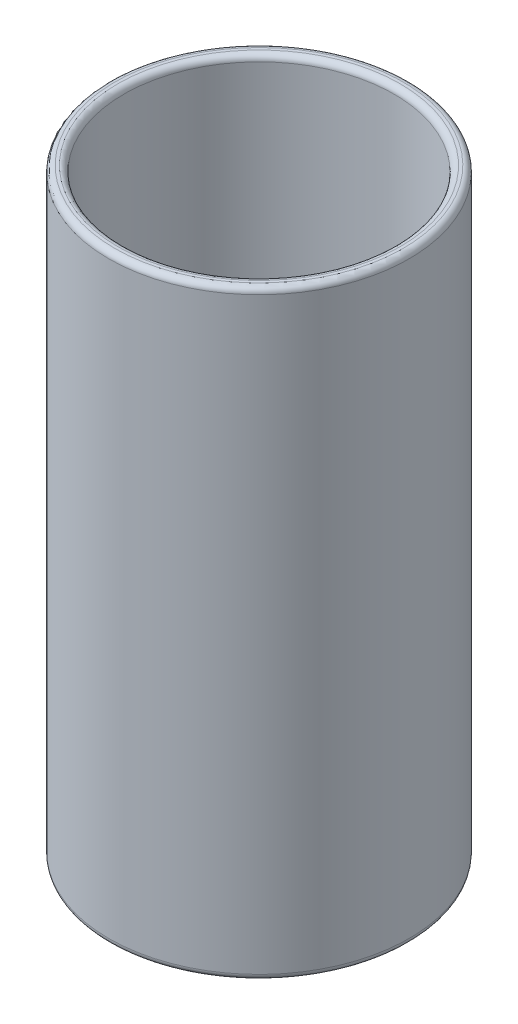
from build123d import *

# Parameters (mm, degrees)
SKETCH1_W          = 50
SKETCH1_H          = 200
SKETCH2_R          = 45
CUT_EXTRUDE1_DEPTH = 195
FILLET2_R          = 2
FILLET3_R          = 2


with BuildPart() as part:
    # Sketch1 → Revolve1 (revolve)
    with BuildSketch(Plane.XY, mode=Mode.PRIVATE) as revolve1_sk:
        with Locations((-25, -134.703470817)):
            Rectangle(SKETCH1_W, SKETCH1_H)
    revolve(revolve1_sk.sketch.rotate(Axis((0, 0, 0), (0, -1, 0)), 270), axis=Axis((0, 0, 0), (0, -1, 0)))

    # Sketch2 → Cut-Extrude1 (cut)
    with BuildSketch(Plane(origin=(0, -34.703470817, 0), x_dir=(1, 0, 0), z_dir=(0, 1, 0))):
        with Locations(Location((0, 0, 0), (0, 0, 270))):
            Circle(SKETCH2_R)
    extrude(amount=-CUT_EXTRUDE1_DEPTH, mode=Mode.SUBTRACT)

    # Fillet2
    fillet2_edges = [part.edges().sort_by_distance(p)[0] for p in [
        (0, -34.703470817, -50),
        (0, -34.703470817, -45),
    ]]
    fillet(fillet2_edges, radius=FILLET2_R)

    # Fillet3
    fillet3_edges = [part.edges().sort_by_distance(p)[0] for p in [
        (0, -234.703470817, -50),
    ]]
    fillet(fillet3_edges, radius=FILLET3_R)


solid = part.part
